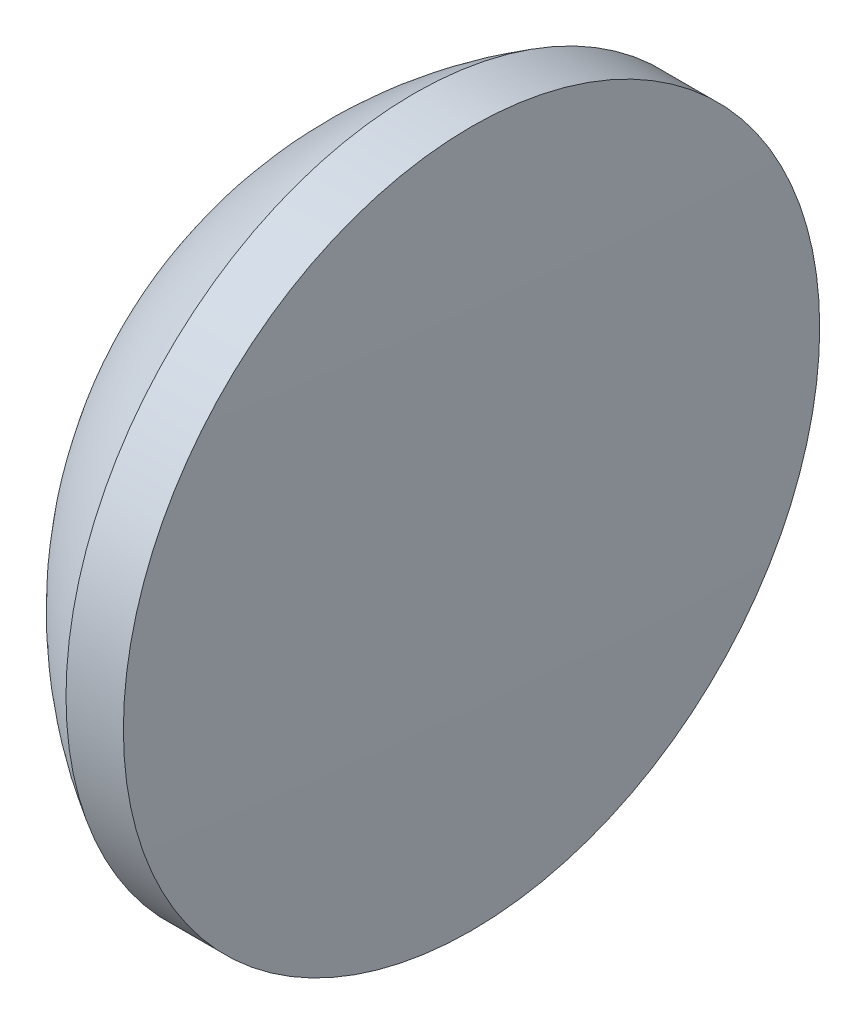
from build123d import *


with BuildPart() as part:
    # 草图1 → 旋转1 (revolve)
    with BuildSketch(Plane.XY):
        with BuildLine():
            Line((-0.695219736, 0), (-2.028818736, 0))
            ThreePointArc((-2.028818736, 0), (-1.755459214, -1.017088203), (-1.009044624, -1.760095))
            Line((-1.009044624, -1.760095), (-0.718960857, -1.760095))
            ThreePointArc((-0.718960857, -1.760095), (-0.701155286, -0.880127555), (-0.695219736, 0))
        make_face()
    revolve(axis=Axis((-2.028818736, 0, 0), (1, 0, 0)))


solid = part.part
